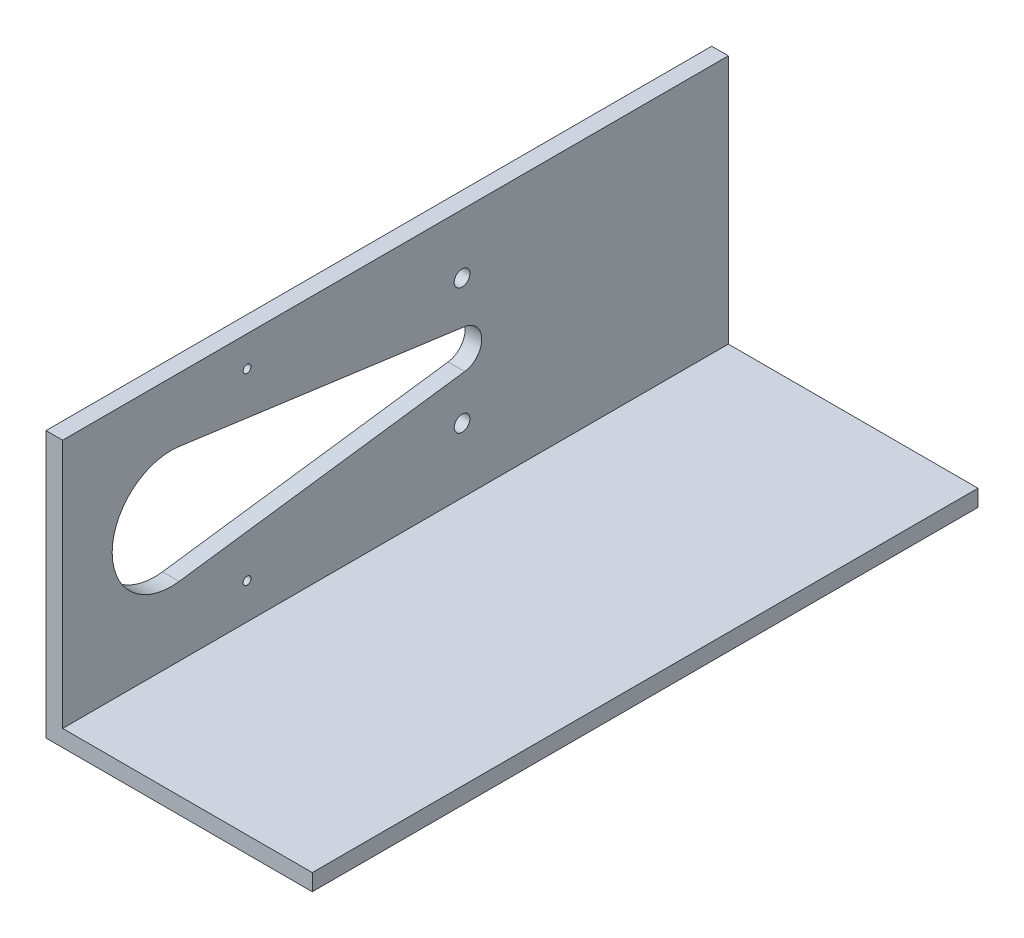
from build123d import *

# Parameters (mm, degrees)
SALIENTE_EXTRUIR1_DEPTH = 254
CROQUIS2_R              = 7.5
CROQUIS2_R_2            = 22.5
CROQUIS2_R_3            = 1.5
CORTAR_EXTRUIR1_DEPTH   = 254
CROQUIS3_R              = 3
CORTAR_EXTRUIR2_DEPTH   = 292.823782444


with BuildPart() as part:
    # Croquis1 → Saliente-Extruir1 (new body)
    with BuildSketch(Plane.XY):
        Polygon((0, 101.6), (0, 0), (101.6, 0), (101.6, 6.35), (6.35, 6.35), (6.35, 101.6), align=None)
    extrude(amount=SALIENTE_EXTRUIR1_DEPTH)

    # Croquis2 → Cortar-Extruir1 (cut)
    with BuildSketch(Plane.ZY):
        with Locations((101.6, 55)):
            Circle(CROQUIS2_R)
        with BuildLine():
            Line((209.559459459, 77.293611489), (100.586486486, 62.43120383))
            ThreePointArc((100.586486486, 62.43120383), (106.531969619, 60.650281026), (109.1, 55))
            ThreePointArc((109.1, 55), (106.531969619, 49.349718974), (100.586486486, 47.56879617))
            Line((100.586486486, 47.56879617), (209.559459459, 32.706388511))
            ThreePointArc((209.559459459, 32.706388511), (190.1, 55), (209.559459459, 77.293611489))
        make_face()
        with Locations((212.6, 55)):
            Circle(CROQUIS2_R_2)
        with Locations(Location((183.64, 90, 0), (0, 0, 270))):
            Circle(CROQUIS2_R_3)
        with Locations(Location((183.64, 20, 0), (0, 0, 270))):
            Circle(CROQUIS2_R_3)
    extrude(amount=-CORTAR_EXTRUIR1_DEPTH, mode=Mode.SUBTRACT)

    # Croquis3 → Cortar-Extruir2 (cut, through all)
    with BuildSketch(Plane.ZY):
        with Locations(Location((101.6, 79, 0), (0, 0, 270))):
            Circle(CROQUIS3_R)
        with Locations(Location((101.6, 31, 0), (0, 0, 270))):
            Circle(CROQUIS3_R)
    extrude(amount=-CORTAR_EXTRUIR2_DEPTH, mode=Mode.SUBTRACT)


solid = part.part
